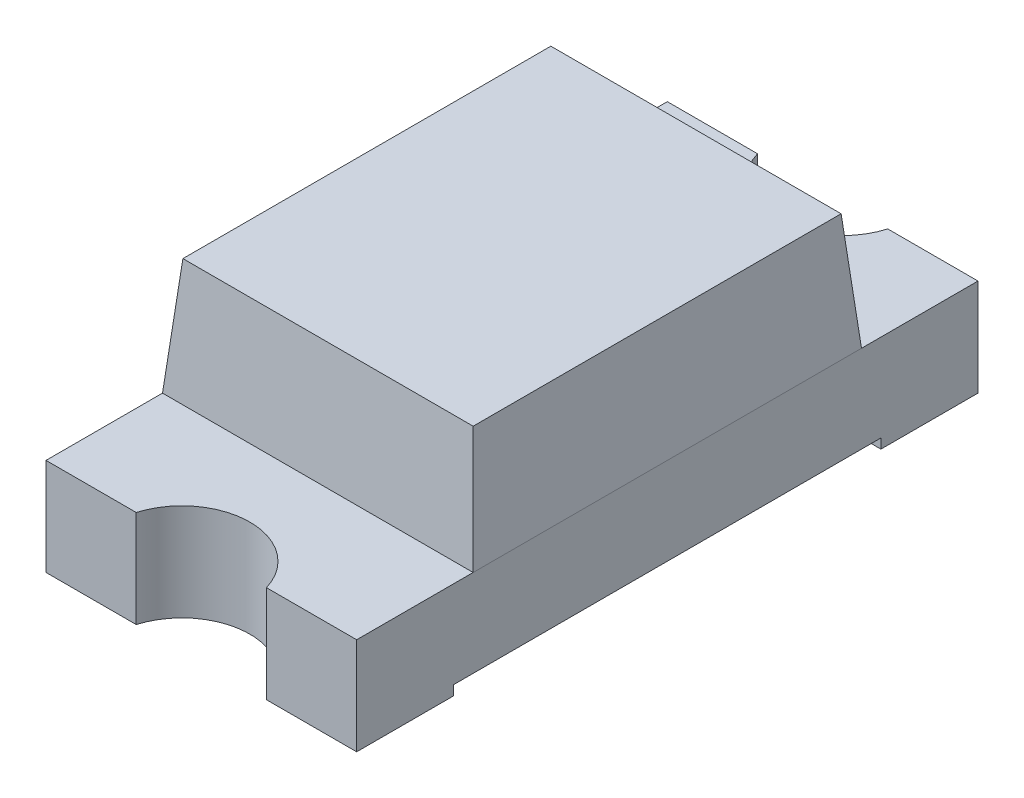
from build123d import *

# Parameters (mm, degrees)
EXTRUDE1_DEPTH      = 0.8
EXTRUDE1_DEPTH_BACK = 0.8
SKETCH2_R           = 0.35
CUT_EXTRUDE1_DEPTH  = 2.857417562
CUT_EXTRUDE2_DEPTH  = 0.005
SKETCH4_W           = 0.39
SKETCH4_H           = 0.39
EXTRUDE2_DEPTH      = 0.25
SKETCH5_W           = 1.6
SKETCH5_H           = 2
EXTRUDE3_DEPTH      = 0.6
EXTRUDE3_TAPER      = 5


with BuildPart() as part:
    # Sketch1 → Extrude1 (new, two sides: drawn at the far end of the back side and taken through both)
    with BuildSketch(Plane(origin=(0, 0, 0), x_dir=(0, 0, -1), z_dir=(1, 0, 0)).offset(-EXTRUDE1_DEPTH_BACK)):
        Polygon((1.1, 0), (1.6, 0), (1.6, 0.5), (-1.6, 0.5), (-1.6, 0), (-1.1, 0), (-1.1, 0.05), (1.1, 0.05), align=None)
    extrude(amount=EXTRUDE1_DEPTH + EXTRUDE1_DEPTH_BACK)

    # Sketch2 → Cut-Extrude1 (cut, through all)
    with BuildSketch(Plane(origin=(0, 0, 0), x_dir=(1, 0, 0), z_dir=(0, 1, 0))):
        with Locations((0, 1.7)):
            Circle(SKETCH2_R)
        with Locations((0, -1.7)):
            Circle(SKETCH2_R)
    extrude(amount=CUT_EXTRUDE1_DEPTH, mode=Mode.SUBTRACT)

    # Sketch3 → Cut-Extrude2 (cut)
    with BuildSketch(Plane(origin=(0, 0.5, 0), x_dir=(-1, 0, 0), z_dir=(0, 1, 0))):
        Polygon((-0.225, -0.225), (0.225, -0.225), (0.225, 0.46368555), (0.225, 0.675), (-0.327379025, 0.675), (-0.327379025, 1), (-0.477379025, 1), (-0.477379025, 0.525), (-0.279401067, 0.525), (0.075, 0.525), (0.075, 0.225), (-0.225, 0.225), align=None)
        Polygon((0.45741461, -0.450698672), (-0.276447509, -0.450698672), (-0.276447509, -0.630698672), (0.27741461, -0.630698672), (0.27741461, -1), (0.45741461, -1), align=None)
    extrude(amount=-CUT_EXTRUDE2_DEPTH, mode=Mode.SUBTRACT)

    # Sketch4 → Extrude2 (add)
    with BuildSketch(Plane(origin=(0, 0.495, 0), x_dir=(-1, 0, 0), z_dir=(0, 1, 0))):
        Rectangle(SKETCH4_W, SKETCH4_H)
    extrude(amount=EXTRUDE2_DEPTH)


with BuildPart() as body_2:
    # Sketch5 → Extrude3 (new body)
    with BuildSketch(Plane(origin=(0, 0.5, 0), x_dir=(-1, 0, 0), z_dir=(0, 1, 0))):
        Rectangle(SKETCH5_W, SKETCH5_H)
    extrude(amount=EXTRUDE3_DEPTH, taper=EXTRUDE3_TAPER)


solid = Compound([part.part, body_2.part])
